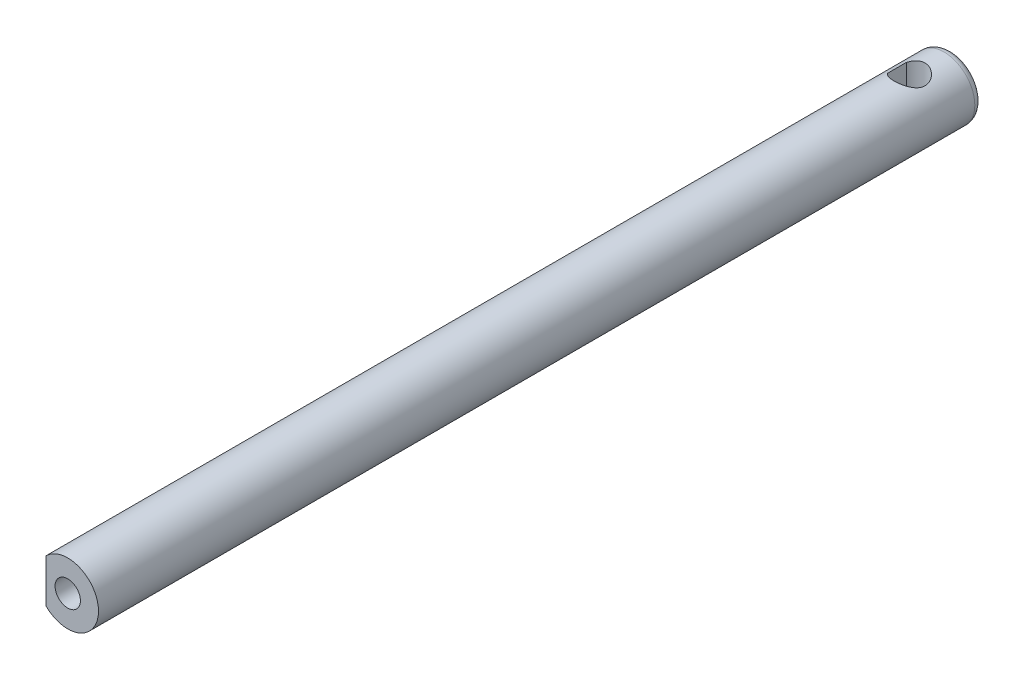
from build123d import *

# Parameters (mm, degrees)
SKETCH_3_R               = 4
EXTRUDE_2_DEPTH          = 57.5
CUT_EXTRUDE_1_DEPTH      = 58.777590812
CUT_EXTRUDE_1_DEPTH_BACK = 58.777590812
FILLET_1_R               = 1
M4X0_7_1_D               = 3.3
M4X0_7_1_DEPTH           = 10
M4X0_7_1_TIP             = 0.991420021
CUT_EXTRUDE_2_DEPTH      = 30


with BuildPart() as part:
    # 草图3 → 凸台-拉伸2 (new, symmetric)
    with BuildSketch(Plane.XY):
        Circle(SKETCH_3_R)
    extrude(amount=EXTRUDE_2_DEPTH, both=True)

    # 草图1 → 切除-拉伸1 (cut, two sides: drawn at the far end of the back side and taken through both)
    with BuildSketch(Plane(origin=(0, 0, 0), x_dir=(1, 0, 0), z_dir=(0, 1, 0)).offset(-CUT_EXTRUDE_1_DEPTH_BACK)):
        with BuildLine():
            Line((-1.625, 50.791695403), (-1.625, 53.208304597))
            ThreePointArc((-1.625, 53.208304597), (2.025, 52), (-1.625, 50.791695403))
        make_face()
    extrude(amount=CUT_EXTRUDE_1_DEPTH + CUT_EXTRUDE_1_DEPTH_BACK, mode=Mode.SUBTRACT)

    # 圆角1
    fillet_1_edges = [part.edges().sort_by_distance(p)[0] for p in [
        (-4, 0, -57.5),
    ]]
    fillet(fillet_1_edges, radius=FILLET_1_R)

    # M4x0.7 螺纹孔1
    with Locations(Plane.XY.offset(57.5)):
        with Locations((0, 0)):
            Hole(M4X0_7_1_D / 2, depth=M4X0_7_1_DEPTH)
            with Locations((0, 0, -(M4X0_7_1_DEPTH + M4X0_7_1_TIP / 2))):  # 118° drill point
                Cone(0, M4X0_7_1_D / 2, M4X0_7_1_TIP, mode=Mode.SUBTRACT)

    # 草图17 → M3x0.5 螺纹孔1 (revolve, cut)
    with BuildSketch(Plane(origin=(-1.625, 0, -52), x_dir=(0, 0, -1), z_dir=(0, 1, 0))):
        Polygon((0, 0), (0, 8.251075774), (1.25, 7.5), (1.25, 0), align=None)
    revolve(axis=Axis((4.725, 0, -52), (-1, 0, 0)), mode=Mode.SUBTRACT)

    # 草图13 → 切除-拉伸2 (cut)
    with BuildSketch(Plane.XY.offset(57.5)):
        with BuildLine():
            ThreePointArc((-2.828427125, 2.828427125), (-4, 0), (-2.828427125, -2.828427125))
            Line((-2.828427125, -2.828427125), (-2.828427125, 2.828427125))
        make_face()
    extrude(amount=-CUT_EXTRUDE_2_DEPTH, mode=Mode.SUBTRACT)


solid = part.part
